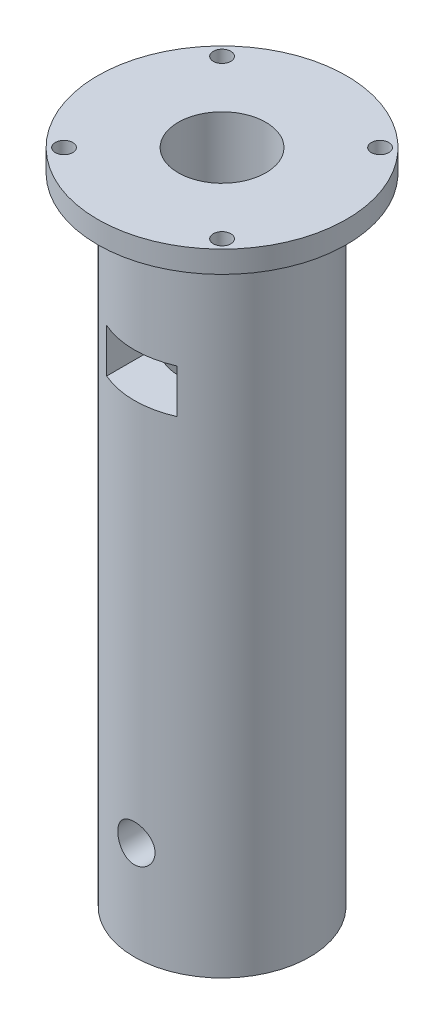
from build123d import *

# Parameters (mm, degrees)
SKETCH_1_R                        = 20
SKETCH_1_R_2                      = 10
EXTRUDE_1_DEPTH                   = 45
HOLE_WIZARD_M10_1_D               = 8.5
HOLE_WIZARD_M10_1_DEPTH           = 12.5
HOLE_WIZARD_M10_1_TIP             = 2.553657631
HOLE_WIZARD_M10_1_ON_FACE_2_D     = 8.5
HOLE_WIZARD_M10_1_ON_FACE_2_DEPTH = 12.5
HOLE_WIZARD_M10_1_ON_FACE_2_TIP   = 2.553657631
SKETCH_4_R                        = 20
SKETCH_4_R_2                      = 10
EXTRUDE_2_DEPTH                   = 105
EXTRUDE_START                     = -5
SKETCH_5_R                        = 28.4
SKETCH_5_R_2                      = 20
EXTRUDE_3_DEPTH                   = 5
HOLE_WIZARD_4_0_4_1_D             = 4
CUT_EXTRUDE_2_DEPTH               = 25


with BuildPart() as part:
    # 草图1 → 凸台-拉伸1 (new body)
    with BuildSketch(Plane(origin=(0, 0, 0), x_dir=(1, 0, 0), z_dir=(0, 1, 0))):
        Circle(SKETCH_1_R)
        Circle(SKETCH_1_R_2, mode=Mode.SUBTRACT)
    extrude(amount=EXTRUDE_1_DEPTH)

    # M10 螺纹孔1
    with Locations(Plane(origin=(0, 22.5, -20), x_dir=(0, -1, 0), z_dir=(0, 0, -1))):
        with Locations((0, 0)):
            Hole(HOLE_WIZARD_M10_1_D / 2, depth=HOLE_WIZARD_M10_1_DEPTH)
            with Locations((0, 0, -(HOLE_WIZARD_M10_1_DEPTH + HOLE_WIZARD_M10_1_TIP / 2))):  # 118° drill point
                Cone(0, HOLE_WIZARD_M10_1_D / 2, HOLE_WIZARD_M10_1_TIP, mode=Mode.SUBTRACT)

    # M10 螺纹孔1 on face 2
    with Locations(Plane(origin=(0, 22.5, 20), x_dir=(1, 0, 0), z_dir=(0, 0, 1))):
        with Locations((0, 0)):
            Hole(HOLE_WIZARD_M10_1_ON_FACE_2_D / 2, depth=HOLE_WIZARD_M10_1_ON_FACE_2_DEPTH)
            with Locations((0, 0, -(HOLE_WIZARD_M10_1_ON_FACE_2_DEPTH + HOLE_WIZARD_M10_1_ON_FACE_2_TIP / 2))):  # 118° drill point
                Cone(0, HOLE_WIZARD_M10_1_ON_FACE_2_D / 2, HOLE_WIZARD_M10_1_ON_FACE_2_TIP, mode=Mode.SUBTRACT)

    # 草图4 → 凸台-拉伸2 (add)
    with BuildSketch(Plane(origin=(0, 45, 0), x_dir=(1, 0, 0), z_dir=(0, 1, 0))):
        Circle(SKETCH_4_R)
        Circle(SKETCH_4_R_2, mode=Mode.SUBTRACT)
    extrude(amount=EXTRUDE_2_DEPTH)

    # 草图5 → 凸台-拉伸3 (add)
    with BuildSketch(Plane(origin=(0, 150, 0), x_dir=(1, 0, 0), z_dir=(0, 1, 0)).offset(EXTRUDE_START)):
        Circle(SKETCH_5_R)
        Circle(SKETCH_5_R_2, mode=Mode.SUBTRACT)
    extrude(amount=EXTRUDE_3_DEPTH)

    # Ø4.0 (4) 直径孔1 (through all)
    with Locations(Plane.XZ.offset(-145)):
        with Locations((-18.03122292, -18.03122292), (-18.03122292, 18.03122292), (18.03122292, 18.03122292), (18.03122292, -18.03122292)):
            Hole(HOLE_WIZARD_4_0_4_1_D / 2)

    # 草图10 → 切除-拉伸2 (cut)
    with BuildSketch(Plane.XY):
        Polygon((0, 120), (8, 120), (8, 110), (-8, 110), (-8, 120), align=None)
    extrude(amount=CUT_EXTRUDE_2_DEPTH, mode=Mode.SUBTRACT)


solid = part.part
